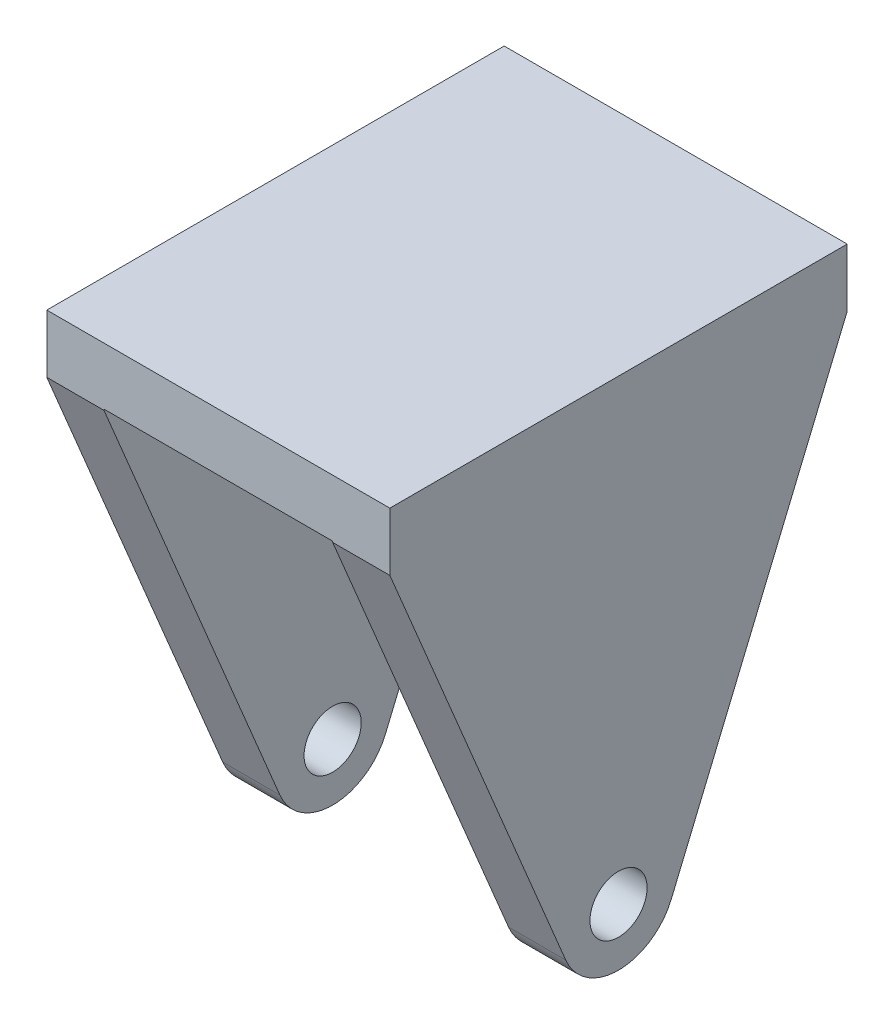
from build123d import *

# Parameters (mm, degrees)
BOSS_EXTRUDE1_DEPTH = 50.8
CUT_EXTRUDE1_REACH  = 89.586


with BuildPart() as part:
    # Sketch1 → Boss-Extrude1 (new body)
    with BuildSketch(Plane.XY):
        Polygon((52.45808334, -3.175), (52.45808334, -60.325), (46.10808334, -60.325), (46.10808334, -9.525), (20.70808334, -9.525), (20.70808334, -60.325), (14.35808334, -60.325), (14.35808334, -3.175), align=None)
    extrude(amount=-BOSS_EXTRUDE1_DEPTH)

    # Cut-Extrude1: up to this face of the body (flat: up to its plane)
    cut_extrude1_end = Plane(part.part.faces().sort_by_distance((52.45808334, -31.75, -25.4))[0])
    # Sketch2 → Cut-Extrude1 (cut, up to the picked face)
    with BuildSketch(Plane.ZY.offset(-14.35808334), mode=Mode.PRIVATE) as cut_extrude1_sk1:
        with BuildLine():
            ThreePointArc((-22.225, -53.975), (-23.15493597, -51.72993597), (-25.4, -50.8))
            Line((-25.4, -50.8), (-25.4, -57.15))
            ThreePointArc((-25.4, -57.15), (-23.15493597, -56.22006403), (-22.225, -53.975))
        make_face()
    cut_extrude1_tool1 = split(extrude(cut_extrude1_sk1.sketch, amount=-CUT_EXTRUDE1_REACH, mode=Mode.PRIVATE), bisect_by=cut_extrude1_end, keep=Keep.BOTH, mode=Mode.PRIVATE)
    # Sketch2 → Cut-Extrude1 (cut, up to the picked face)
    with BuildSketch(Plane.ZY.offset(-14.35808334), mode=Mode.PRIVATE) as cut_extrude1_sk2:
        with BuildLine():
            Line((-25.4, -57.15), (-25.4, -50.8))
            ThreePointArc((-25.4, -50.8), (-28.575, -53.975), (-25.4, -57.15))
        make_face()
    cut_extrude1_tool2 = split(extrude(cut_extrude1_sk2.sketch, amount=-CUT_EXTRUDE1_REACH, mode=Mode.PRIVATE), bisect_by=cut_extrude1_end, keep=Keep.BOTH, mode=Mode.PRIVATE)
    # Sketch2 → Cut-Extrude1 (cut, up to the picked face)
    with BuildSketch(Plane.ZY.offset(-14.35808334), mode=Mode.PRIVATE) as cut_extrude1_sk3:
        with BuildLine():
            ThreePointArc((-22.225, -53.975), (-23.15493597, -51.72993597), (-25.4, -50.8))
            Line((-25.4, -50.8), (-25.4, -57.15))
            ThreePointArc((-25.4, -57.15), (-23.15493597, -56.22006403), (-22.225, -53.975))
        make_face()
    cut_extrude1_tool3 = split(extrude(cut_extrude1_sk3.sketch, amount=-CUT_EXTRUDE1_REACH, mode=Mode.PRIVATE), bisect_by=cut_extrude1_end, keep=Keep.BOTH, mode=Mode.PRIVATE)
    # Sketch2 → Cut-Extrude1 (cut, up to the picked face)
    with BuildSketch(Plane.ZY.offset(-14.35808334), mode=Mode.PRIVATE) as cut_extrude1_sk4:
        with BuildLine():
            Line((-25.4, -57.15), (-25.4, -50.8))
            ThreePointArc((-25.4, -50.8), (-28.575, -53.975), (-25.4, -57.15))
        make_face()
    cut_extrude1_tool4 = split(extrude(cut_extrude1_sk4.sketch, amount=-CUT_EXTRUDE1_REACH, mode=Mode.PRIVATE), bisect_by=cut_extrude1_end, keep=Keep.BOTH, mode=Mode.PRIVATE)
    # Sketch2 → Cut-Extrude1 (cut, up to the picked face)
    with BuildSketch(Plane.ZY.offset(-14.35808334), mode=Mode.PRIVATE) as cut_extrude1_sk5:
        with BuildLine():
            Line((0, -9.643805147), (-19.540665388, -56.422590224))
            ThreePointArc((-19.540665388, -56.422590224), (-21.880035364, -59.260106334), (-25.4, -60.325))
            Line((-25.4, -60.325), (0, -60.325))
            Line((0, -60.325), (0, -9.643805147))
        make_face()
    cut_extrude1_tool5 = split(extrude(cut_extrude1_sk5.sketch, amount=-CUT_EXTRUDE1_REACH, mode=Mode.PRIVATE), bisect_by=cut_extrude1_end, keep=Keep.BOTH, mode=Mode.PRIVATE)
    # Sketch2 → Cut-Extrude1 (cut, up to the picked face)
    with BuildSketch(Plane.ZY.offset(-14.35808334), mode=Mode.PRIVATE) as cut_extrude1_sk6:
        with BuildLine():
            ThreePointArc((-25.4, -60.325), (-28.919964636, -59.260106334), (-31.259334612, -56.422590224))
            Line((-31.259334612, -56.422590224), (-50.8, -9.643805147))
            Line((-50.8, -9.643805147), (-50.8, -60.325))
            Line((-50.8, -60.325), (-25.4, -60.325))
        make_face()
    cut_extrude1_tool6 = split(extrude(cut_extrude1_sk6.sketch, amount=-CUT_EXTRUDE1_REACH, mode=Mode.PRIVATE), bisect_by=cut_extrude1_end, keep=Keep.BOTH, mode=Mode.PRIVATE)
    add(cut_extrude1_tool1.solids().sort_by(Axis((14.358083, -53.975, -24.052488), (1, 0, 0)))[0], mode=Mode.SUBTRACT)
    add(cut_extrude1_tool2.solids().sort_by(Axis((14.358083, -53.975, -26.747512), (1, 0, 0)))[0], mode=Mode.SUBTRACT)
    add(cut_extrude1_tool3.solids().sort_by(Axis((14.358083, -53.975, -24.052488), (1, 0, 0)))[0], mode=Mode.SUBTRACT)
    add(cut_extrude1_tool4.solids().sort_by(Axis((14.358083, -53.975, -26.747512), (1, 0, 0)))[0], mode=Mode.SUBTRACT)
    add(cut_extrude1_tool5.solids().sort_by(Axis((14.358083, -43.525452, -7.142919), (1, 0, 0)))[0], mode=Mode.SUBTRACT)
    add(cut_extrude1_tool6.solids().sort_by(Axis((14.358083, -43.525452, -43.657081), (1, 0, 0)))[0], mode=Mode.SUBTRACT)


solid = part.part
